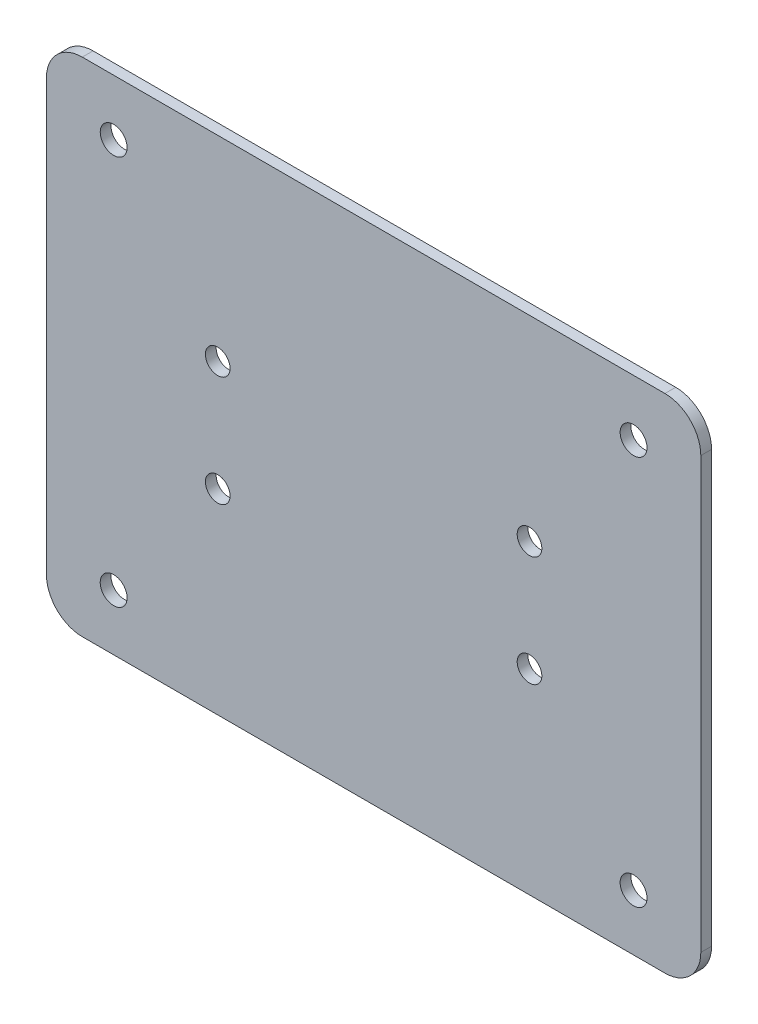
from build123d import *

# Parameters (mm, degrees)
SKETCH1_W           = 73
SKETCH1_H           = 56
SKETCH1_R           = 1.5
BOSS_EXTRUDE1_DEPTH = 1.2
FILLET1_R           = 4
CUT_EXTRUDE1_REACH  = 94.013
SKETCH2_R           = 1.375


with BuildPart() as part:
    # Sketch1 → Boss-Extrude1 (new body)
    with BuildSketch(Plane.XY):
        with Locations((36.5, 28)):
            Rectangle(SKETCH1_W, SKETCH1_H)
        with Locations((7.5, 6.25)):
            Circle(SKETCH1_R, mode=Mode.SUBTRACT)
        with Locations(Location((65.5, 6.25, 0), (0, 0, 180))):
            Circle(SKETCH1_R, mode=Mode.SUBTRACT)
        with Locations((65.5, 49.75)):
            Circle(SKETCH1_R, mode=Mode.SUBTRACT)
        with Locations(Location((7.5, 49.75, 0), (0, 0, 180))):
            Circle(SKETCH1_R, mode=Mode.SUBTRACT)
    extrude(amount=BOSS_EXTRUDE1_DEPTH)

    # Fillet1
    fillet1_edges = [part.edges().sort_by_distance(p)[0] for p in [
        (0, 56, 0.6),
        (73, 56, 0.6),
        (73, 0, 0.6),
        (0, 0, 0.6),
    ]]
    fillet(fillet1_edges, radius=FILLET1_R)

    # Sketch2 → Cut-Extrude1 (cut, up to next)
    with BuildSketch(Plane.XY.offset(1.2), mode=Mode.PRIVATE) as cut_extrude1_sk1:
        with Locations((53.89, 21.84)):
            Circle(SKETCH2_R)
    cut_extrude1_tool1 = extrude(cut_extrude1_sk1.sketch, amount=-CUT_EXTRUDE1_REACH, mode=Mode.PRIVATE) & part.part
    # Sketch2 → Cut-Extrude1 (cut, up to next)
    with BuildSketch(Plane.XY.offset(1.2), mode=Mode.PRIVATE) as cut_extrude1_sk2:
        with Locations(Location((53.89, 34.16, 0), (0, 0, 180))):
            Circle(SKETCH2_R)
    cut_extrude1_tool2 = extrude(cut_extrude1_sk2.sketch, amount=-CUT_EXTRUDE1_REACH, mode=Mode.PRIVATE) & part.part
    # Sketch2 → Cut-Extrude1 (cut, up to next)
    with BuildSketch(Plane.XY.offset(1.2), mode=Mode.PRIVATE) as cut_extrude1_sk3:
        with Locations(Location((19.11, 21.84, 0), (0, 0, 180))):
            Circle(SKETCH2_R)
    cut_extrude1_tool3 = extrude(cut_extrude1_sk3.sketch, amount=-CUT_EXTRUDE1_REACH, mode=Mode.PRIVATE) & part.part
    # Sketch2 → Cut-Extrude1 (cut, up to next)
    with BuildSketch(Plane.XY.offset(1.2), mode=Mode.PRIVATE) as cut_extrude1_sk4:
        with Locations((19.11, 34.16)):
            Circle(SKETCH2_R)
    cut_extrude1_tool4 = extrude(cut_extrude1_sk4.sketch, amount=-CUT_EXTRUDE1_REACH, mode=Mode.PRIVATE) & part.part
    add(cut_extrude1_tool1.solids().sort_by_distance((53.89, 21.84, 1.2))[0], mode=Mode.SUBTRACT)
    add(cut_extrude1_tool2.solids().sort_by_distance((53.89, 34.16, 1.2))[0], mode=Mode.SUBTRACT)
    add(cut_extrude1_tool3.solids().sort_by_distance((19.11, 21.84, 1.2))[0], mode=Mode.SUBTRACT)
    add(cut_extrude1_tool4.solids().sort_by_distance((19.11, 34.16, 1.2))[0], mode=Mode.SUBTRACT)


solid = part.part
